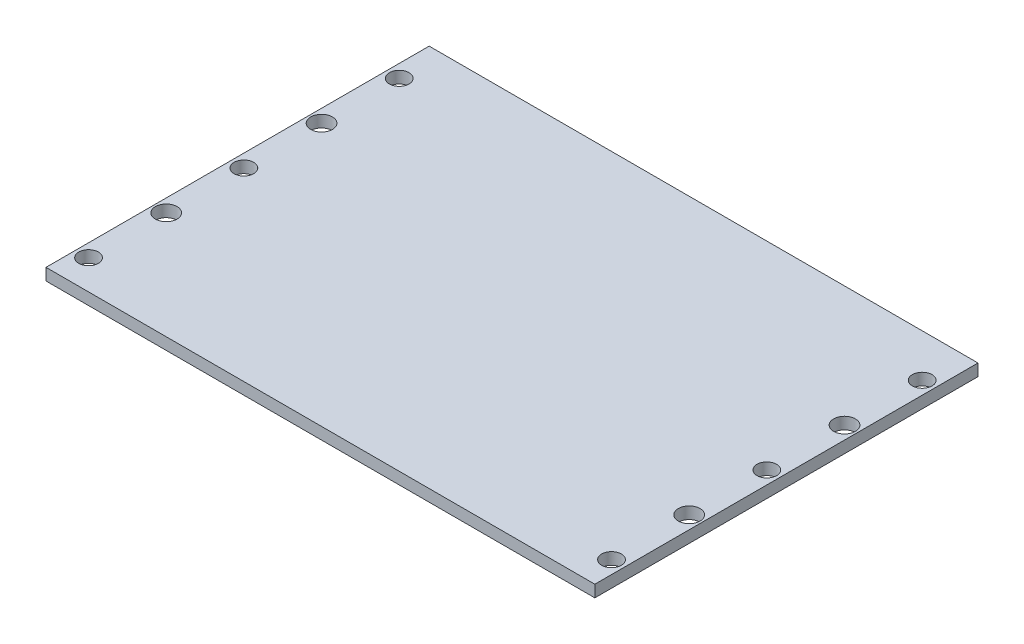
from build123d import *

# Parameters (mm, degrees)
SKETCH1_W           = 106
SKETCH1_H           = 74
BOSS_EXTRUDE1_DEPTH = 2.29
SKETCH2_R           = 1.9
SKETCH2_R_2         = 2.1
CUT_EXTRUDE1_DEPTH  = 127.847325947


with BuildPart() as part:
    # Sketch1 → Boss-Extrude1 (new body)
    with BuildSketch(Plane(origin=(0, 0, 0), x_dir=(1, 0, 0), z_dir=(0, 1, 0))):
        with Locations((50, 37)):
            Rectangle(SKETCH1_W, SKETCH1_H)
    extrude(amount=BOSS_EXTRUDE1_DEPTH)

    # Sketch2 → Cut-Extrude1 (cut, through all)
    with BuildSketch(Plane(origin=(0, 2.29, 0), x_dir=(1, 0, 0), z_dir=(0, 1, 0))):
        with Locations(Location((-0.5, 5.72, 0), (0, 0, 270))):
            Circle(SKETCH2_R)
        with Locations(Location((100.5, 5.72, 0), (0, 0, 270))):
            Circle(SKETCH2_R)
        with Locations(Location((100.5, 35.72, 0), (0, 0, 270))):
            Circle(SKETCH2_R)
        with Locations(Location((100.5, 65.72, 0), (0, 0, 270))):
            Circle(SKETCH2_R)
        with Locations(Location((-0.5, 35.72, 0), (0, 0, 270))):
            Circle(SKETCH2_R)
        with Locations(Location((-0.5, 65.72, 0), (0, 0, 270))):
            Circle(SKETCH2_R)
        with Locations(Location((-0.5, 20.72, 0), (0, 0, 270))):
            Circle(SKETCH2_R_2)
        with Locations(Location((100.5, 20.72, 0), (0, 0, 270))):
            Circle(SKETCH2_R_2)
        with Locations(Location((100.5, 50.72, 0), (0, 0, 270))):
            Circle(SKETCH2_R_2)
        with Locations(Location((-0.5, 50.72, 0), (0, 0, 270))):
            Circle(SKETCH2_R_2)
    extrude(amount=-CUT_EXTRUDE1_DEPTH, mode=Mode.SUBTRACT)


solid = part.part
